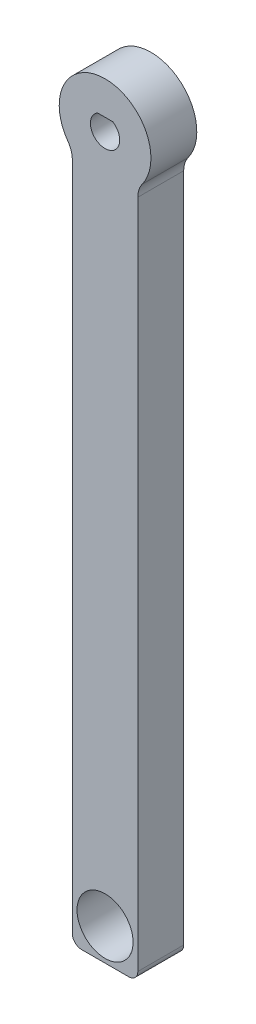
from build123d import *

# Parameters (mm, degrees)
SKETCH1_R           = 10
BOSS_EXTRUDE1_DEPTH = 10
CUT_EXTRUDE1_DEPTH  = 10
SKETCH3_W           = 14.282856858
SKETCH3_H           = 10
BOSS_EXTRUDE2_DEPTH = 150
SKETCH4_R           = 6.11
CUT_EXTRUDE2_DEPTH  = 10
FILLET1_R           = 5
FILLET2_R           = 2


with BuildPart() as part:
    # Sketch1 → Boss-Extrude1 (new body)
    with BuildSketch(Plane.XY):
        Circle(SKETCH1_R)
        with BuildLine():
            ThreePointArc((-1.666643333, 2.72), (0, -3.19), (1.666643333, 2.72))
            Line((1.666643333, 2.72), (-1.666643333, 2.72))
        make_face(mode=Mode.SUBTRACT)
    extrude(amount=BOSS_EXTRUDE1_DEPTH)

    # Sketch2 → Cut-Extrude1 (cut)
    with BuildSketch(Plane(origin=(0, 0, 0), x_dir=(-1, 0, 0), z_dir=(0, 0, -1))):
        with BuildLine():
            Line((7.141428429, -7), (-7.141428429, -7))
            ThreePointArc((-7.141428429, -7), (-3.872983346, -9.219544457), (0, -10))
            ThreePointArc((0, -10), (3.872983346, -9.219544457), (7.141428429, -7))
        make_face()
    extrude(amount=-CUT_EXTRUDE1_DEPTH, mode=Mode.SUBTRACT)

    # Sketch3 → Boss-Extrude2 (add)
    with BuildSketch(Plane.XZ.offset(7)):
        with Locations((0, 5)):
            Rectangle(SKETCH3_W, SKETCH3_H)
    extrude(amount=BOSS_EXTRUDE2_DEPTH)

    # Sketch4 → Cut-Extrude2 (cut)
    with BuildSketch(Plane(origin=(0, 0, 0), x_dir=(-1, 0, 0), z_dir=(0, 0, -1))):
        with Locations((0, -150)):
            Circle(SKETCH4_R)
    extrude(amount=-CUT_EXTRUDE2_DEPTH, mode=Mode.SUBTRACT)

    # Fillet1
    fillet1_edges = [part.edges().sort_by_distance(p)[0] for p in [
        (7.141428429, -7, 5),
        (-7.141428429, -7, 5),
    ]]
    fillet(fillet1_edges, radius=FILLET1_R)

    # Fillet2
    fillet2_edges = [part.edges().sort_by_distance(p)[0] for p in [
        (-7.141428429, -157, 5),
        (7.141428429, -157, 5),
    ]]
    fillet(fillet2_edges, radius=FILLET2_R)


solid = part.part
